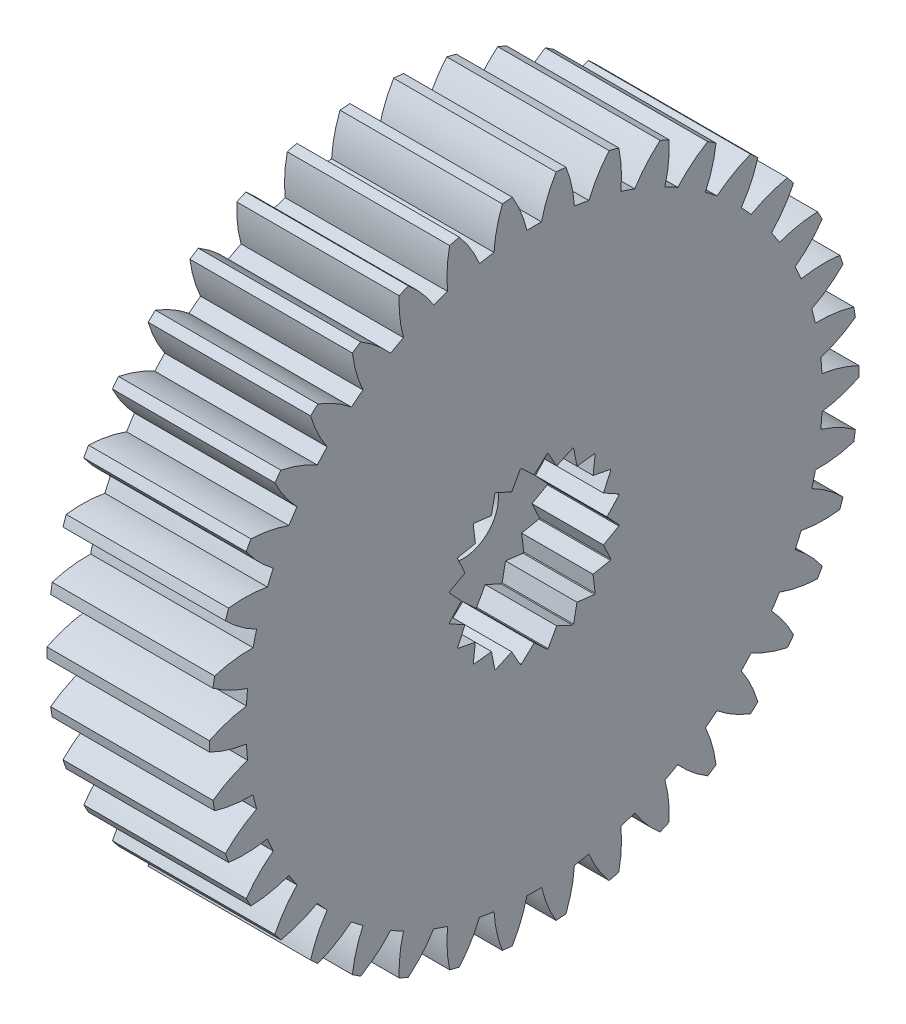
from build123d import *

# Parameters (mm, degrees)
BASPROSKE_W             = 5
BASPROSKE_H             = 10
TOOTHCUT_DEPTH          = 16
TEETHCUTS_COUNT         = 38
TEETHCUTS_ANGLE         = 350.526315789
BORSKE_R                = 0.4
BORE_DEPTH              = 50.0000508
SKETCH3_R               = 2.64
CUT_EXTRUDE1_DEPTH      = 2.2
BOSS_EXTRUDE1_DEPTH     = 2.2
CIRPATTERN1_COUNT       = 20
SKETCH5_R               = 2
CUT_EXTRUDE2_DEPTH      = 1.8
CUT_EXTRUDE3_DEPTH      = 15.48401305
CUT_EXTRUDE3_DEPTH_BACK = 15.48401305
SKETCH6_R               = 1.1


with BuildPart() as part:
    # BasProSke → Base-Revolve (revolve)
    with BuildSketch(Plane(origin=(0, 0, 0), x_dir=(1, 0, 0), z_dir=(0, 1, 0)), mode=Mode.PRIVATE) as base_revolve_sk:
        with Locations((2.5, 5)):
            Rectangle(BASPROSKE_W, BASPROSKE_H)
    revolve(base_revolve_sk.sketch.rotate(Axis((-10, 0, 0), (1, 0, 0)), 180), axis=Axis((-10, 0, 0), (1, 0, 0)))

    # TooCutSke → ToothCut (cut, through all)
    with BuildSketch(Plane(origin=(0, 0, 0), x_dir=(0, 0, -1), z_dir=(1, 0, 0))):
        with BuildLine():
            ThreePointArc((0.225646216, 8.871130694), (0, 8.874), (-0.225646216, 8.871130694))
            ThreePointArc((-0.225646216, 8.871130694), (-0.411182885, 9.455149371), (-0.688178469, 10.001752624))
            ThreePointArc((-0.688178469, 10.001752624), (0, 10.0254), (0.688178469, 10.001752624))
            ThreePointArc((0.688178469, 10.001752624), (0.411182885, 9.455149371), (0.225646216, 8.871130694))
        make_face()
    toothcut = extrude(amount=TOOTHCUT_DEPTH, mode=Mode.SUBTRACT)

    # TeethCuts: ToothCut ×38 about axis
    teethcuts_axis = Axis((-10, 0, 0), (1, 0, 0))
    for i in range(1, TEETHCUTS_COUNT):
        add(toothcut.rotate(teethcuts_axis, i * TEETHCUTS_ANGLE / (TEETHCUTS_COUNT - 1)), mode=Mode.SUBTRACT)

    # BorSke → Bore (cut, symmetric)
    with BuildSketch(Plane(origin=(0, 0, 0), x_dir=(0, 0, -1), z_dir=(1, 0, 0))):
        with Locations(Location((0, 0, 0), (0, 0, 180))):
            Circle(BORSKE_R)
    extrude(amount=BORE_DEPTH, both=True, mode=Mode.SUBTRACT)

    # Sketch3 → Cut-Extrude1 (cut)
    with BuildSketch(Plane(origin=(5, 0, 0), x_dir=(0, 0, -1), z_dir=(1, 0, 0))):
        Circle(SKETCH3_R)
    extrude(amount=-CUT_EXTRUDE1_DEPTH, mode=Mode.SUBTRACT)

    # Sketch4 → Boss-Extrude1 (add)
    with BuildSketch(Plane(origin=(5, 0, 0), x_dir=(0, 0, -1), z_dir=(1, 0, 0))):
        Polygon((0, 2.24), (0.430666667, 2.64), (-0.430666667, 2.64), align=None)
    boss_extrude1 = extrude(amount=-BOSS_EXTRUDE1_DEPTH)

    # CirPattern1: Boss-Extrude1 ×20 about axis
    cirpattern1_axis = Axis((0, 0, 0), (1, 0, 0))
    for i in range(1, CIRPATTERN1_COUNT):
        add(boss_extrude1.rotate(cirpattern1_axis, i * 360 / CIRPATTERN1_COUNT))

    # Sketch5 → Cut-Extrude2 (cut)
    with BuildSketch(Plane.ZY):
        Circle(SKETCH5_R)
    extrude(amount=-CUT_EXTRUDE2_DEPTH, mode=Mode.SUBTRACT)

    # Sketch6 → Cut-Extrude3 (cut, two sides: drawn at the far end of the back side and taken through both)
    with BuildSketch(Plane.ZY.offset(-1.8).offset(-CUT_EXTRUDE3_DEPTH_BACK)):
        with Locations(Location((0, 0, 0), (0, 0, 180))):
            Circle(SKETCH6_R)
    extrude(amount=CUT_EXTRUDE3_DEPTH + CUT_EXTRUDE3_DEPTH_BACK, mode=Mode.SUBTRACT)


solid = part.part
